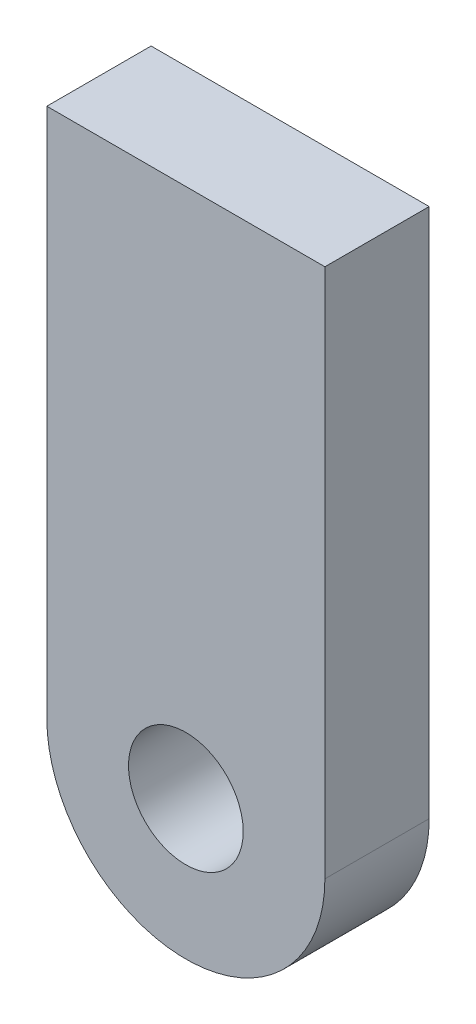
from build123d import *

# Parameters (mm, degrees)
SKETCH_1_R      = 1.65
EXTRUDE_1_DEPTH = 3


with BuildPart() as part:
    # 草图1 → 凸台-拉伸1 (new body)
    with BuildSketch(Plane.XY):
        with BuildLine():
            Line((-4, 0), (-4, 15.25))
            Line((-4, 15.25), (4, 15.25))
            Line((4, 15.25), (4, 0))
            ThreePointArc((4, 0), (0, -4), (-4, 0))
        make_face()
        Circle(SKETCH_1_R, mode=Mode.SUBTRACT)
    extrude(amount=EXTRUDE_1_DEPTH)


solid = part.part
